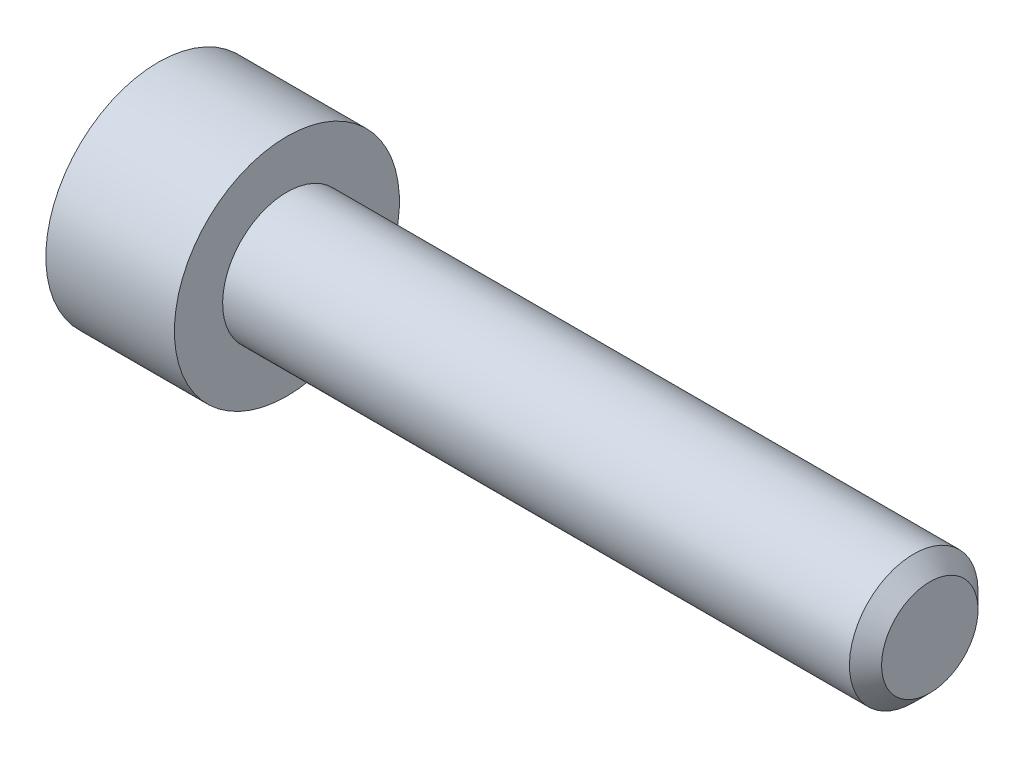
from build123d import *

# Parameters (mm, degrees)
CUT_EXTRUDE_1_DEPTH = 2


with BuildPart() as part:
    # 草圖1 → 旋轉1 (revolve)
    with BuildSketch(Plane.XY):
        Polygon((-4, 0), (-4, 3.5), (0, 3.5), (0, 2), (19.5, 2), (20, 1.5), (20, 0), align=None)
    revolve(axis=Axis((20, 0, 0), (-1, 0, 0)))

    # 草圖2 → 除料-旋轉1 (revolve, cut)
    with BuildSketch(Plane.XY):
        Polygon((-4, 0), (-4, 1.5), (-2, 1.5), (-1.598076211, 0), align=None)
    revolve(axis=Axis((-1.598076211, 0, 0), (-1, 0, 0)), mode=Mode.SUBTRACT)

    # 草圖3 → 除料-伸長1 (cut)
    with BuildSketch(Plane(origin=(-4, 0, 0), x_dir=(0, 0, -1), z_dir=(1, 0, 0))):
        Polygon((-1.5, 0.866025404), (-1.5, -0.866025404), (0, -1.732050808), (1.5, -0.866025404), (1.5, 0.866025404), (0, 1.732050808), align=None)
    extrude(amount=CUT_EXTRUDE_1_DEPTH, mode=Mode.SUBTRACT)


solid = part.part
